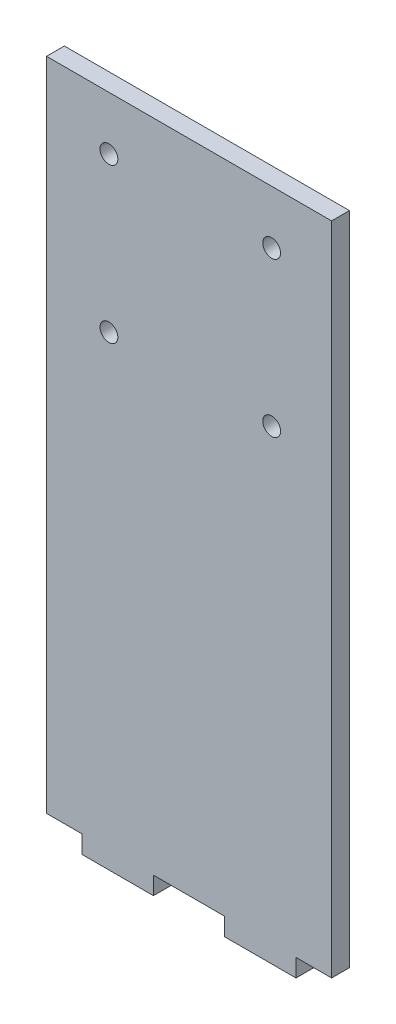
from build123d import *

# Parameters (mm, degrees)
SKETCH1_R           = 1.5875
BOSS_EXTRUDE1_DEPTH = 3.175


with BuildPart() as part:
    # Sketch1 → Boss-Extrude1 (new body)
    with BuildSketch(Plane.XY):
        Polygon((50.8, 116.84), (11.1125, 116.84), (0, 116.84), (0, 0), (6.35, 0), (6.35, -3.175), (19.05, -3.175), (19.05, 0), (31.75, 0), (31.75, -3.175), (44.45, -3.175), (44.45, 0), (50.8, 0), align=None)
        with BuildLine():
            ThreePointArc((11.1125, 78.2275), (9.525, 79.815), (11.1125, 81.4025))
            ThreePointArc((11.1125, 81.4025), (12.235032015, 80.937532015), (12.7, 79.815))
            ThreePointArc((12.7, 79.815), (12.235032015, 78.692467985), (11.1125, 78.2275))
        make_face(mode=Mode.SUBTRACT)
        with BuildLine():
            ThreePointArc((11.1125, 105.7275), (9.525, 107.315), (11.1125, 108.9025))
            ThreePointArc((11.1125, 108.9025), (12.235032015, 108.437532015), (12.7, 107.315))
            ThreePointArc((12.7, 107.315), (12.235032015, 106.192467985), (11.1125, 105.7275))
        make_face(mode=Mode.SUBTRACT)
        with Locations((40.1125, 79.815)):
            Circle(SKETCH1_R, mode=Mode.SUBTRACT)
        with Locations((40.1125, 107.315)):
            Circle(SKETCH1_R, mode=Mode.SUBTRACT)
    extrude(amount=BOSS_EXTRUDE1_DEPTH)


solid = part.part
